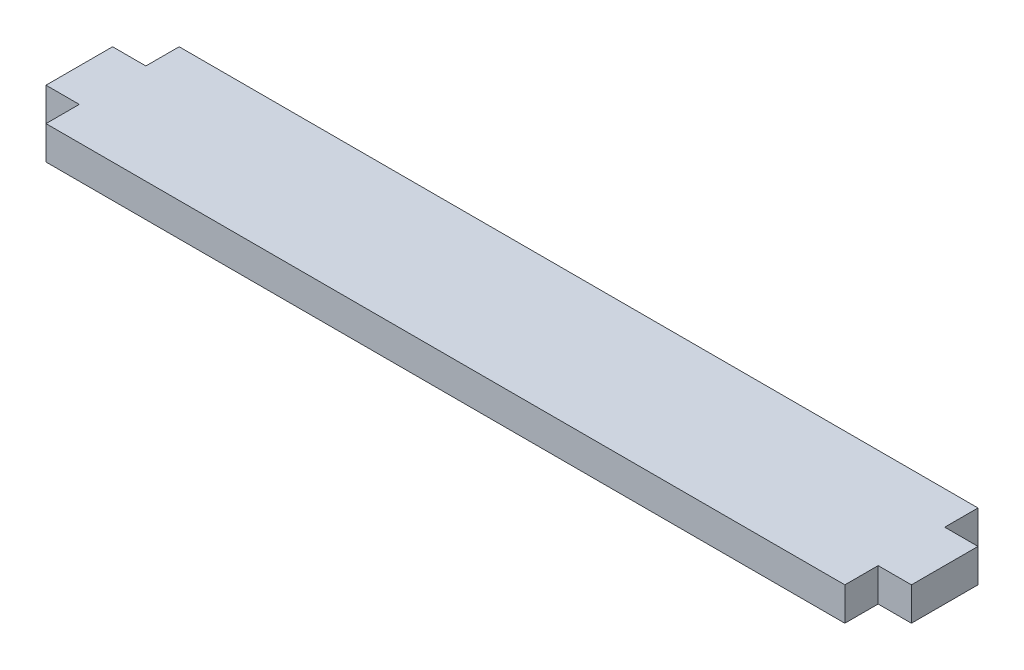
from build123d import *

# Parameters (mm, degrees)
SKETCH1_W           = 152.4
SKETCH1_H           = 25.4
BOSS_EXTRUDE1_DEPTH = 6.35
SKETCH3_W           = 6.35
SKETCH3_H           = 12.7
BOSS_EXTRUDE2_DEPTH = 6.35


with BuildPart() as part:
    # Sketch1 → Boss-Extrude1 (new body)
    with BuildSketch(Plane(origin=(0, 0, 0), x_dir=(1, 0, 0), z_dir=(0, 1, 0))):
        with Locations((76.2, -12.7)):
            Rectangle(SKETCH1_W, SKETCH1_H)
    extrude(amount=BOSS_EXTRUDE1_DEPTH)

    # Sketch3 → Boss-Extrude2 (add)
    with BuildSketch(Plane(origin=(0, 6.35, 0), x_dir=(1, 0, 0), z_dir=(0, 1, 0))):
        with Locations((-3.175, -12.7)):
            Rectangle(SKETCH3_W, SKETCH3_H)
    boss_extrude2 = extrude(amount=-BOSS_EXTRUDE2_DEPTH)

    # Mirror1: Boss-Extrude2 across plane
    add(boss_extrude2.mirror(Plane.ZY.offset(-76.2)))


solid = part.part
